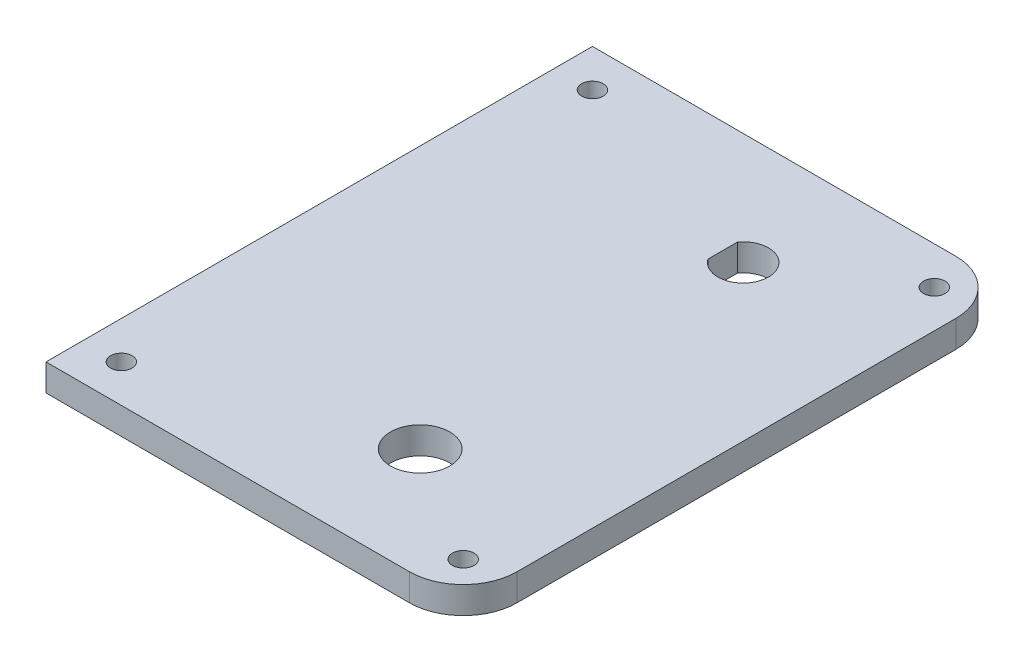
from build123d import *

# Parameters (mm, degrees)
SKETCH3_R           = 2
SKETCH3_R_2         = 5.5
BOSS_EXTRUDE2_DEPTH = 5


with BuildPart() as part:
    # Sketch3 → Boss-Extrude2 (new body)
    with BuildSketch(Plane(origin=(0, 0, 0), x_dir=(1, 0, 0), z_dir=(0, 1, 0))):
        with BuildLine():
            Line((-38.75, 50.75), (28.75, 50.75))
            ThreePointArc((28.75, 50.75), (35.821067812, 47.821067812), (38.75, 40.75))
            Line((38.75, 40.75), (38.75, -40.75))
            ThreePointArc((38.75, -40.75), (35.821067812, -47.821067812), (28.75, -50.75))
            Line((28.75, -50.75), (-38.75, -50.75))
            Line((-38.75, -50.75), (-38.75, 50.75))
        make_face()
        with Locations(Location((-31.75, -43.75, 0), (0, 0, 270))):
            Circle(SKETCH3_R, mode=Mode.SUBTRACT)
        with Locations(Location((-31.75, 43.75, 0), (0, 0, 270))):
            Circle(SKETCH3_R, mode=Mode.SUBTRACT)
        with Locations(Location((31.75, 43.75, 0), (0, 0, 270))):
            Circle(SKETCH3_R, mode=Mode.SUBTRACT)
        with Locations(Location((31.75, -43.75, 0), (0, 0, 270))):
            Circle(SKETCH3_R, mode=Mode.SUBTRACT)
        with Locations(Location((10, -30, 0), (0, 0, 270))):
            Circle(SKETCH3_R_2, mode=Mode.SUBTRACT)
        with BuildLine():
            Line((6.188504231, 32.75), (6.188504231, 27.25))
            ThreePointArc((6.188504231, 27.25), (14.7, 30), (6.188504231, 32.75))
        make_face(mode=Mode.SUBTRACT)
    extrude(amount=BOSS_EXTRUDE2_DEPTH)


solid = part.part
